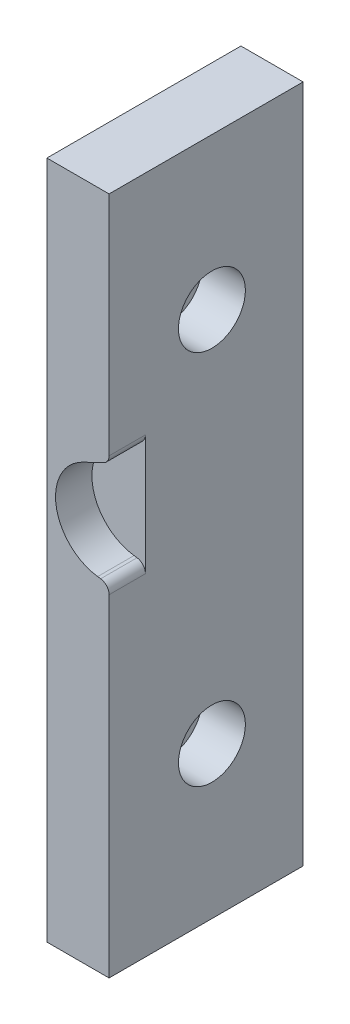
from build123d import *

# Parameters (mm, degrees)
SKETCH1_W           = 16.2814
SKETCH1_H           = 177.8
BOSS_EXTRUDE1_DEPTH = 25.4
SKETCH2_R           = 6.75767
CUT_EXTRUDE1_DEPTH  = 94.879997795
SKETCH3_R           = 8.7641176
CUT_EXTRUDE2_DEPTH  = 11.3284
CUT_EXTRUDE3_DEPTH  = 9.525
FILLET1_R           = 2.54


with BuildPart() as part:
    # Sketch1 → Boss-Extrude1 (new, symmetric)
    with BuildSketch(Plane.XY):
        Rectangle(SKETCH1_W, SKETCH1_H)
    extrude(amount=BOSS_EXTRUDE1_DEPTH, both=True)

    # Sketch2 → Cut-Extrude1 (cut, through all)
    with BuildSketch(Plane(origin=(8.1407, 0, 0), x_dir=(0, 0, -1), z_dir=(1, 0, 0))):
        with Locations((1.524, 49.211738)):
            Circle(SKETCH2_R)
        with Locations((1.524, -49.211738)):
            Circle(SKETCH2_R)
    extrude(amount=-CUT_EXTRUDE1_DEPTH, mode=Mode.SUBTRACT)

    # Sketch3 → Cut-Extrude2 (cut)
    with BuildSketch(Plane(origin=(8.1407, 0, 0), x_dir=(0, 0, -1), z_dir=(1, 0, 0))):
        with Locations((1.524, 49.211738)):
            Circle(SKETCH3_R)
        with Locations((1.524, -49.211738)):
            Circle(SKETCH3_R)
    extrude(amount=-CUT_EXTRUDE2_DEPTH, mode=Mode.SUBTRACT)

    # Sketch5 → Cut-Extrude3 (cut)
    with BuildSketch(Plane.XY.offset(25.4)):
        with BuildLine():
            Line((1.3843, 24.702073714), (8.1407, 27.901182182))
            Line((8.1407, 27.901182182), (8.1407, 0.236876892))
            Line((8.1407, 0.236876892), (5.147798748, 0.634218973))
            ThreePointArc((5.147798748, 0.634218973), (-5.728317972, 11.261694019), (1.3843, 24.702073714))
        make_face()
    extrude(amount=-CUT_EXTRUDE3_DEPTH, mode=Mode.SUBTRACT)

    # Fillet1
    fillet1_edges = [part.edges().sort_by_distance(p)[0] for p in [
        (8.1407, 27.901182182, 20.6375),
        (8.1407, 0.236876892, 20.6375),
    ]]
    fillet(fillet1_edges, radius=FILLET1_R)


solid = part.part
